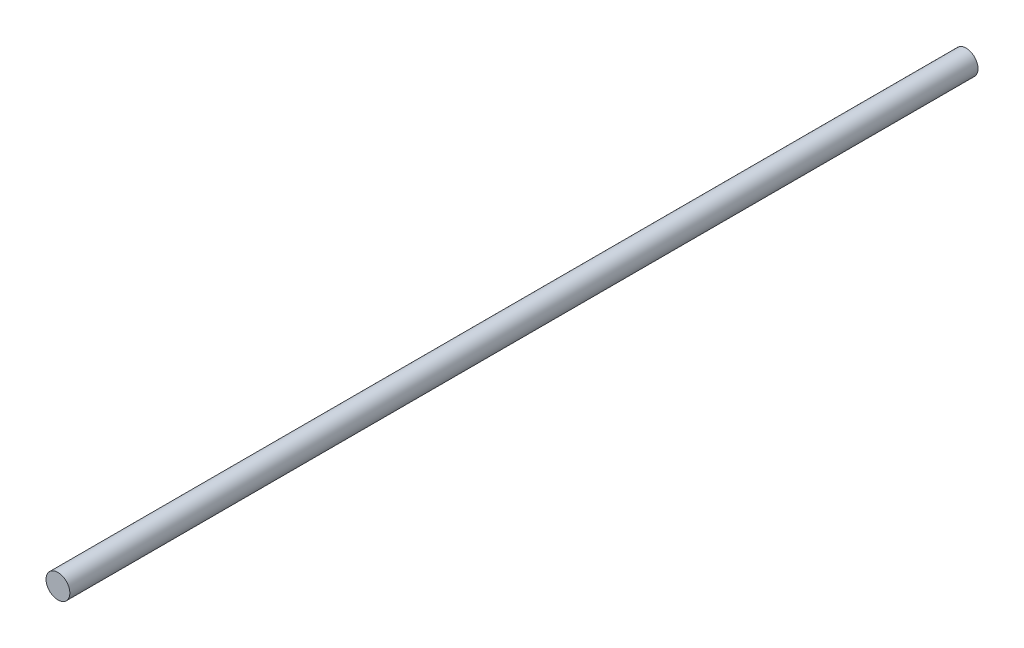
from build123d import *

# Parameters (mm, degrees)
SKETCH1_R           = 6
BOSS_EXTRUDE1_DEPTH = 457.2


with BuildPart() as part:
    # Sketch1 → Boss-Extrude1 (new body)
    with BuildSketch(Plane.XY):
        with Locations(Location((0, 0, 0), (0, 0, 180))):
            Circle(SKETCH1_R)
    extrude(amount=BOSS_EXTRUDE1_DEPTH)


solid = part.part
